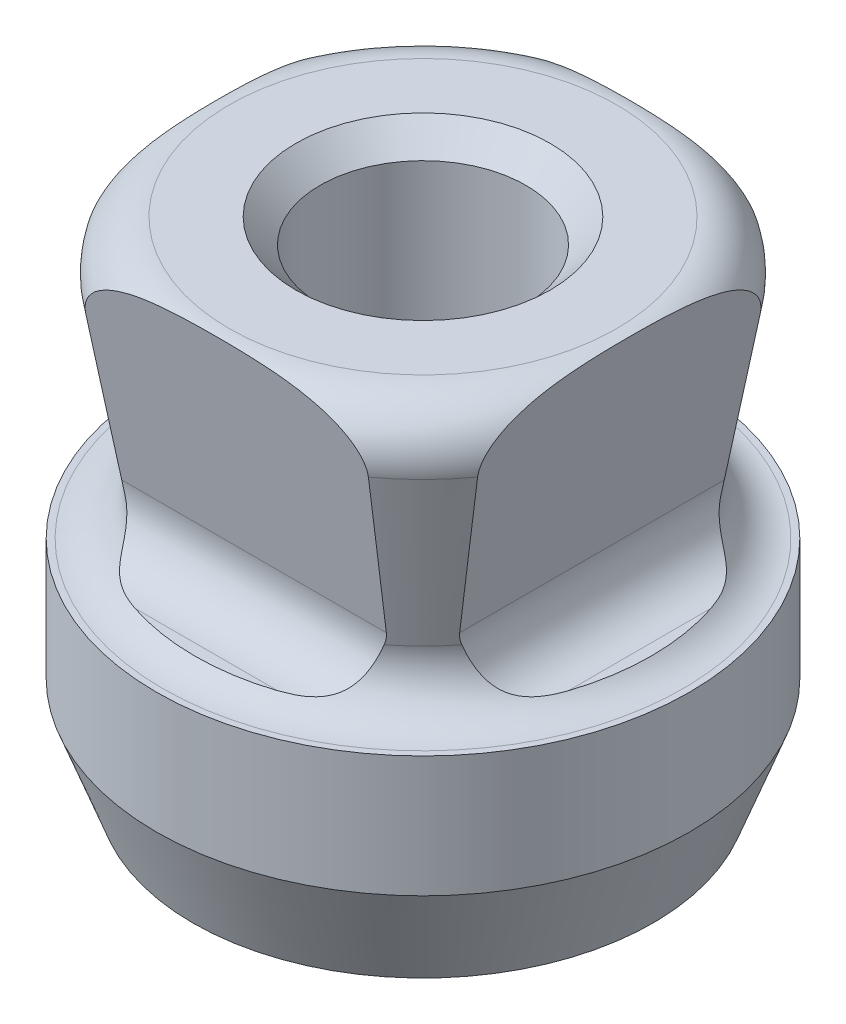
from build123d import *

# Parameters (mm, degrees)
SKETCH2_R          = 4.25
CUT_EXTRUDE1_DEPTH = 26.734218465
CHAMFER1_SIZE      = 1
CUT_EXTRUDE2_DEPTH = 26.734218465
CIRPATTERN1_COUNT  = 4


with BuildPart() as part:
    # Sketch1 → Revolve1 (revolve)
    with BuildSketch(Plane.XY, mode=Mode.PRIVATE) as revolve1_sk:
        with BuildLine():
            Line((0, 20.5), (-8, 20.5))
            ThreePointArc((-8, 20.5), (-9.532088886, 19.785575219), (-9.969615506, 18.152703645))
            Line((-9.969615506, 18.152703645), (-8.769638586, 11.347296355))
            ThreePointArc((-8.769638586, 11.347296355), (-9.207165206, 9.714424781), (-10.739254092, 9))
            Line((-10.739254092, 9), (-11, 9))
            Line((-11, 9), (-11, 4))
            Line((-11, 4), (-9.5, 0))
            Line((-9.5, 0), (-8.75, 0))
            Line((-8.75, 0), (0, 8.75))
            Line((0, 8.75), (0, 20.5))
        make_face()
    revolve(revolve1_sk.sketch.rotate(Axis((0, 20.5, 0), (0, -1, 0)), 270), axis=Axis((0, 20.5, 0), (0, -1, 0)))

    # Sketch2 → Cut-Extrude1 (cut, through all)
    with BuildSketch(Plane(origin=(0, 20.5, 0), x_dir=(1, 0, 0), z_dir=(0, 1, 0))):
        with Locations(Location((0, 0, 0), (0, 0, 270))):
            Circle(SKETCH2_R)
    extrude(amount=-CUT_EXTRUDE1_DEPTH, mode=Mode.SUBTRACT)

    # Chamfer1
    chamfer1_edges = [part.edges().sort_by_distance(p)[0] for p in [
        (0, 20.5, -4.25),
    ]]
    chamfer(chamfer1_edges, length=CHAMFER1_SIZE)

    # Sketch3 → Cut-Extrude2 (cut, symmetric)
    with BuildSketch(Plane(origin=(0, 0, 0), x_dir=(0, 0, -1), z_dir=(1, 0, 0))):
        with BuildLine():
            Line((-8.5, 20.5), (-6.974294891, 11.847296355))
            ThreePointArc((-6.974294891, 11.847296355), (-7.411821511, 10.214424781), (-8.943910397, 9.5))
            Line((-8.943910397, 9.5), (-13.5, 9.5))
            Line((-13.5, 9.5), (-13.5, 20.5))
            Line((-13.5, 20.5), (-8.5, 20.5))
        make_face()
    cut_extrude2 = extrude(amount=CUT_EXTRUDE2_DEPTH, both=True, mode=Mode.SUBTRACT)

    # CirPattern1: Cut-Extrude2 ×4 about axis
    cirpattern1_axis = Axis((0, 0, 0), (0, 1, 0))
    for i in range(1, CIRPATTERN1_COUNT):
        add(cut_extrude2.rotate(cirpattern1_axis, i * 360 / CIRPATTERN1_COUNT), mode=Mode.SUBTRACT)


solid = part.part
